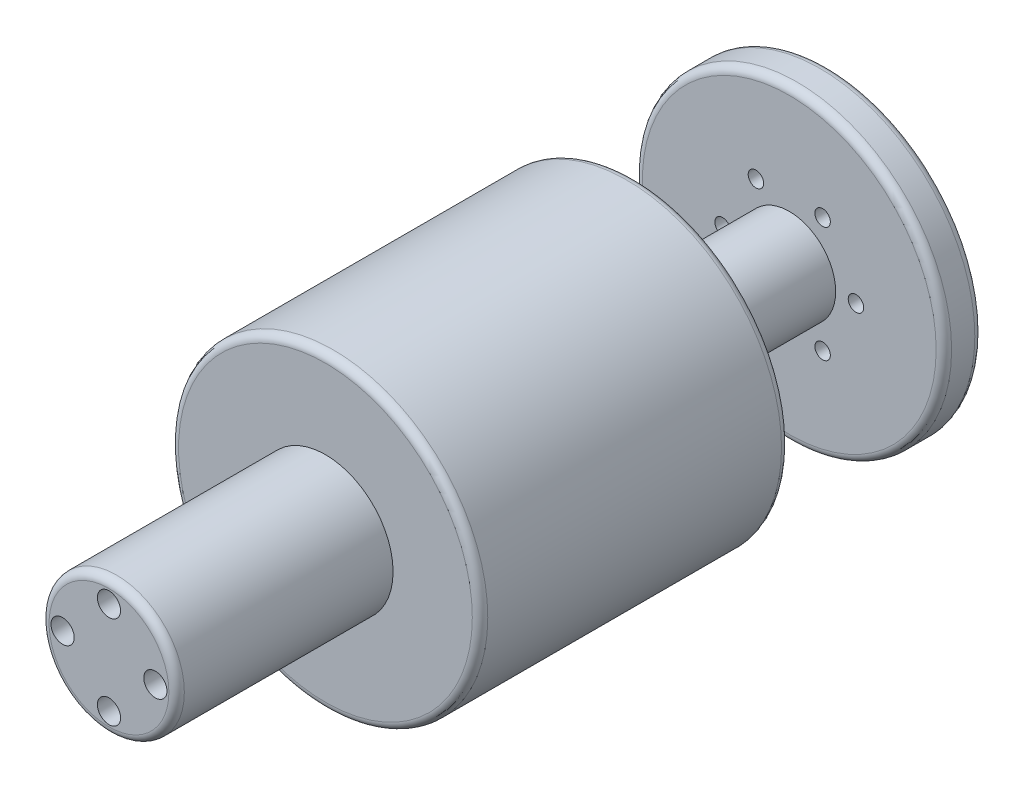
from build123d import *

# Parameters (mm, degrees)
SKETCH_1_R               = 40
SKETCH_1_R_2             = 2
EXTRUDE_2_DEPTH          = 10
SKETCH_3_R               = 12
EXTRUDE_4_DEPTH          = 40
SKETCH_4_R               = 40
EXTRUDE_7_DEPTH          = 80
SKETCH_7_R               = 17.5
EXTRUDE_8_DEPTH          = 56
SKETCH_9_R               = 3
CUT_EXTRUDE_2_DEPTH      = 100
SKETCH_11_R              = 3
CUT_EXTRUDE_4_DEPTH      = 20
PATTERN_CIRCULAR_1_COUNT = 4
FILLET_1_R               = 2


with BuildPart() as part:
    # 草图1 → 凸台-拉伸2 (new body)
    with BuildSketch(Plane.XY):
        Circle(SKETCH_1_R)
        with Locations((-17.25, 0)):
            Circle(SKETCH_1_R_2, mode=Mode.SUBTRACT)
        with Locations((-8.625, 14.938938215)):
            Circle(SKETCH_1_R_2, mode=Mode.SUBTRACT)
        with Locations((8.625, 14.938938215)):
            Circle(SKETCH_1_R_2, mode=Mode.SUBTRACT)
        with Locations((17.25, 0)):
            Circle(SKETCH_1_R_2, mode=Mode.SUBTRACT)
        with Locations((8.625, -14.938938215)):
            Circle(SKETCH_1_R_2, mode=Mode.SUBTRACT)
        with Locations((-8.625, -14.938938215)):
            Circle(SKETCH_1_R_2, mode=Mode.SUBTRACT)
    extrude(amount=EXTRUDE_2_DEPTH)

    # 草图3 → 凸台-拉伸4 (add)
    with BuildSketch(Plane.XY.offset(10)):
        Circle(SKETCH_3_R)
    extrude(amount=EXTRUDE_4_DEPTH)

    # 草图4 → 凸台-拉伸7 (add)
    with BuildSketch(Plane.XY.offset(50)):
        Circle(SKETCH_4_R)
    extrude(amount=EXTRUDE_7_DEPTH)

    # 草图7 → 凸台-拉伸8 (add)
    with BuildSketch(Plane.XY.offset(130)):
        Circle(SKETCH_7_R)
    extrude(amount=EXTRUDE_8_DEPTH)

    # 草图9 → 切除-拉伸2 (cut)
    with BuildSketch(Plane(origin=(0, 0, 0), x_dir=(1, 0, 0), z_dir=(0, 1, 0))):
        with Locations(Location((0, -90, 0), (0, 0, 270))):
            Circle(SKETCH_9_R)
        with Locations(Location((0, -70, 0), (0, 0, 270))):
            Circle(SKETCH_9_R)
        with Locations(Location((0, -110, 0), (0, 0, 270))):
            Circle(SKETCH_9_R)
    extrude(amount=-CUT_EXTRUDE_2_DEPTH, mode=Mode.SUBTRACT)

    # 草图11 → 切除-拉伸4 (cut)
    with BuildSketch(Plane.XY.offset(186)):
        with Locations((-12, 0)):
            Circle(SKETCH_11_R)
    cut_extrude_4 = extrude(amount=-CUT_EXTRUDE_4_DEPTH, mode=Mode.SUBTRACT)

    # 阵列(圆周)1: 切除-拉伸4 ×4 about axis
    pattern_circular_1_axis = Axis((0, 0, 0), (0, 0, 1))
    for i in range(1, PATTERN_CIRCULAR_1_COUNT):
        add(cut_extrude_4.rotate(pattern_circular_1_axis, i * 360 / PATTERN_CIRCULAR_1_COUNT), mode=Mode.SUBTRACT)

    # 圆角1
    fillet_1_edges = [part.edges().sort_by_distance(p)[0] for p in [
        (-40, 0, 0),
        (-40, 0, 50),
        (-40, 0, 130),
        (-17.5, 0, 186),
        (-40, 0, 10),
    ]]
    fillet(fillet_1_edges, radius=FILLET_1_R)


solid = part.part
